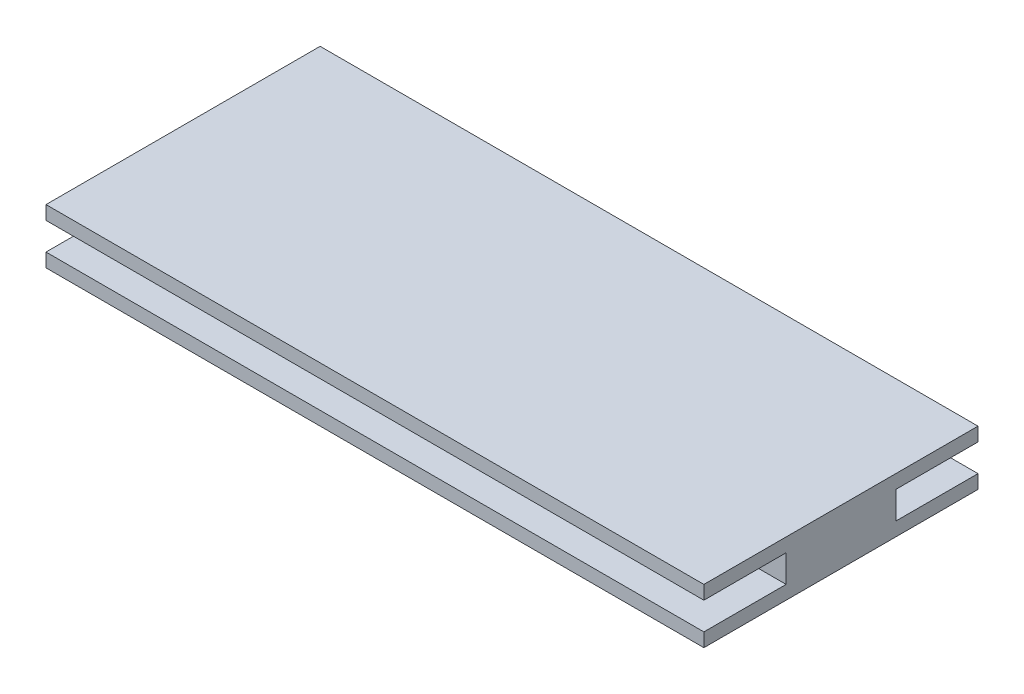
from build123d import *

# Parameters (mm, degrees)
BOSS_EXTRUDE1_DEPTH = 76.2


with BuildPart() as part:
    # Sketch1 → Boss-Extrude1 (new body)
    with BuildSketch(Plane(origin=(0, 0, 0), x_dir=(0, 0, -1), z_dir=(1, 0, 0))):
        Polygon((-15.875, 1.5875), (-15.875, 3.175), (15.875, 3.175), (15.875, 1.5875), (6.35, 1.5875), (6.35, -1.5875), (15.875, -1.5875), (15.875, -3.175), (-15.875, -3.175), (-15.875, -1.5875), (-6.35, -1.5875), (-6.35, 1.5875), align=None)
    extrude(amount=BOSS_EXTRUDE1_DEPTH)


solid = part.part
